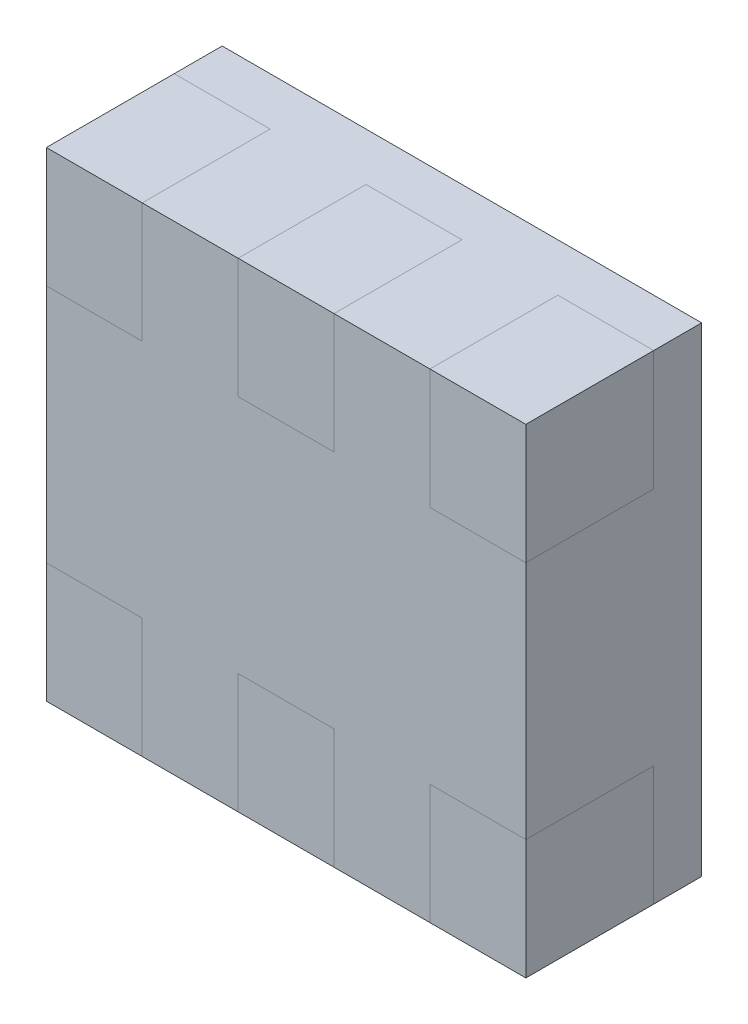
from build123d import *

# Parameters (mm, degrees)
SKETCH1_W           = 3
SKETCH1_H           = 3
BOSS_EXTRUDE1_DEPTH = 1.1
SKETCH2_W           = 0.6
SKETCH2_H           = 0.75
CUT_EXTRUDE1_DEPTH  = 0.8
BOSS_EXTRUDE3_REACH = 4.39
SKETCH2_5_W         = 0.6
SKETCH2_5_H         = 0.75


with BuildPart() as part:
    # Sketch1 → Boss-Extrude1 (new body)
    with BuildSketch(Plane.XY):
        Rectangle(SKETCH1_W, SKETCH1_H)
    extrude(amount=BOSS_EXTRUDE1_DEPTH)

    # Sketch2 → Cut-Extrude1 (cut)
    with BuildSketch(Plane.XY.offset(1.1)):
        with Locations((0, 1.125)):
            Rectangle(SKETCH2_W, SKETCH2_H)
        with Locations((1.2, 1.125)):
            Rectangle(SKETCH2_W, SKETCH2_H)
        with Locations((1.2, -1.125)):
            Rectangle(SKETCH2_W, SKETCH2_H)
        with Locations((-1.2, -1.125)):
            Rectangle(SKETCH2_W, SKETCH2_H)
        with Locations((0, -1.125)):
            Rectangle(SKETCH2_W, SKETCH2_H)
        with Locations((-1.2, 1.125)):
            Rectangle(SKETCH2_W, SKETCH2_H)
    extrude(amount=-CUT_EXTRUDE1_DEPTH, mode=Mode.SUBTRACT)


with BuildPart() as body_2:

    # Sketch2<5> → Boss-Extrude3 (new, up to next)
    with BuildSketch(Plane.XY.offset(1.1), mode=Mode.PRIVATE) as boss_extrude3_sk1:
        with Locations((0, 1.125)):
            Rectangle(SKETCH2_5_W, SKETCH2_5_H)
    boss_extrude3_tool1 = extrude(boss_extrude3_sk1.sketch, amount=-BOSS_EXTRUDE3_REACH, mode=Mode.PRIVATE) - part.part
    # Sketch2<5> → Boss-Extrude3 (new, up to next)
    with BuildSketch(Plane.XY.offset(1.1), mode=Mode.PRIVATE) as boss_extrude3_sk2:
        with Locations((1.2, 1.125)):
            Rectangle(SKETCH2_5_W, SKETCH2_5_H)
    boss_extrude3_tool2 = extrude(boss_extrude3_sk2.sketch, amount=-BOSS_EXTRUDE3_REACH, mode=Mode.PRIVATE) - part.part
    # Sketch2<5> → Boss-Extrude3 (new, up to next)
    with BuildSketch(Plane.XY.offset(1.1), mode=Mode.PRIVATE) as boss_extrude3_sk3:
        with Locations((1.2, -1.125)):
            Rectangle(SKETCH2_5_W, SKETCH2_5_H)
    boss_extrude3_tool3 = extrude(boss_extrude3_sk3.sketch, amount=-BOSS_EXTRUDE3_REACH, mode=Mode.PRIVATE) - part.part
    # Sketch2<5> → Boss-Extrude3 (new, up to next)
    with BuildSketch(Plane.XY.offset(1.1), mode=Mode.PRIVATE) as boss_extrude3_sk4:
        with Locations((-1.2, -1.125)):
            Rectangle(SKETCH2_5_W, SKETCH2_5_H)
    boss_extrude3_tool4 = extrude(boss_extrude3_sk4.sketch, amount=-BOSS_EXTRUDE3_REACH, mode=Mode.PRIVATE) - part.part
    # Sketch2<5> → Boss-Extrude3 (new, up to next)
    with BuildSketch(Plane.XY.offset(1.1), mode=Mode.PRIVATE) as boss_extrude3_sk5:
        with Locations((0, -1.125)):
            Rectangle(SKETCH2_5_W, SKETCH2_5_H)
    boss_extrude3_tool5 = extrude(boss_extrude3_sk5.sketch, amount=-BOSS_EXTRUDE3_REACH, mode=Mode.PRIVATE) - part.part
    # Sketch2<5> → Boss-Extrude3 (new, up to next)
    with BuildSketch(Plane.XY.offset(1.1), mode=Mode.PRIVATE) as boss_extrude3_sk6:
        with Locations((-1.2, 1.125)):
            Rectangle(SKETCH2_5_W, SKETCH2_5_H)
    boss_extrude3_tool6 = extrude(boss_extrude3_sk6.sketch, amount=-BOSS_EXTRUDE3_REACH, mode=Mode.PRIVATE) - part.part
    add(boss_extrude3_tool1.solids().sort_by_distance((0, 1.125, 1.1))[0])
    add(boss_extrude3_tool2.solids().sort_by_distance((1.2, 1.125, 1.1))[0])
    add(boss_extrude3_tool3.solids().sort_by_distance((1.2, -1.125, 1.1))[0])
    add(boss_extrude3_tool4.solids().sort_by_distance((-1.2, -1.125, 1.1))[0])
    add(boss_extrude3_tool5.solids().sort_by_distance((0, -1.125, 1.1))[0])
    add(boss_extrude3_tool6.solids().sort_by_distance((-1.2, 1.125, 1.1))[0])


solid = Compound([part.part, body_2.part])
